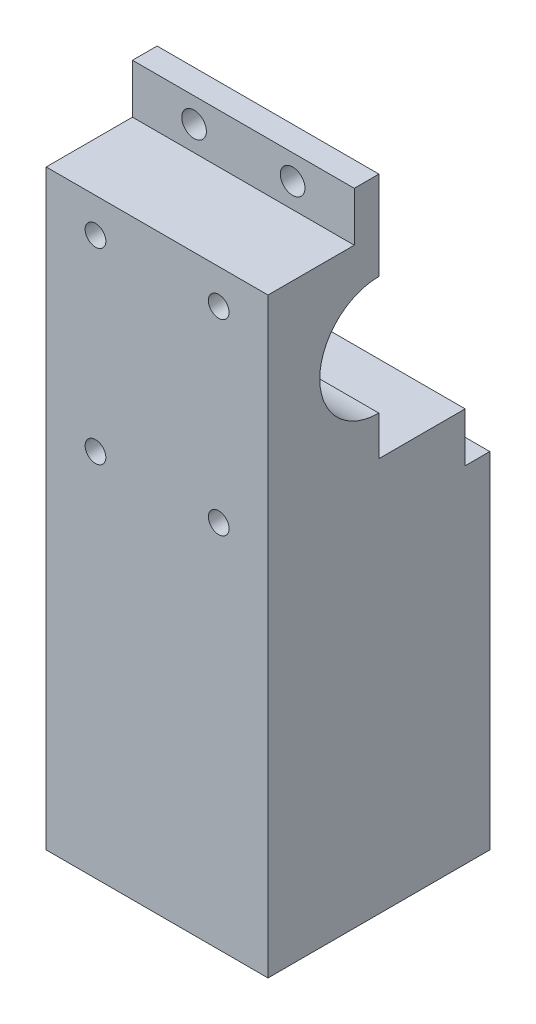
from build123d import *

# Parameters (mm, degrees)
SKETCH_1_W                       = 45
SKETCH_1_H                       = 45
EXTRUDE_1_DEPTH                  = 80
HOLE_WIZARD_M36_1_D              = 32
HOLE_WIZARD_M36_1_DEPTH          = 50
HOLE_WIZARD_M36_1_CSINK_D        = 38
HOLE_WIZARD_M36_1_CSINK_ANGLE    = 90
HOLE_WIZARD_M36_1_TIP            = 9.613769904
SKETCH_6_W                       = 5
SKETCH_6_H                       = 10
EXTRUDE_2_DEPTH                  = 45
SKETCH_7_R                       = 2.5
CUT_EXTRUDE_1_DEPTH              = 135.768319719
SKETCH_8_W                       = 5
SKETCH_8_H                       = 10
CUT_EXTRUDE_2_DEPTH              = 140.396018595
HOLE_WIZARD_M5_1_D               = 4.2
HOLE_WIZARD_M5_1_DEPTH           = 15
HOLE_WIZARD_M5_1_TIP             = 1.2618073
HOLE_WIZARD_M5_2_D               = 4.2
HOLE_WIZARD_M5_2_DEPTH           = 10
HOLE_WIZARD_M5_2_TIP             = 1.2618073
HOLE_WIZARD_M5_2_ON_FACE_2_D     = 4.2
HOLE_WIZARD_M5_2_ON_FACE_2_DEPTH = 10
HOLE_WIZARD_M5_2_ON_FACE_2_TIP   = 1.2618073


with BuildPart() as part:
    # 草图1 → 凸台-拉伸1 (new body)
    with BuildSketch(Plane(origin=(0, 0, 0), x_dir=(1, 0, 0), z_dir=(0, 1, 0))):
        Rectangle(SKETCH_1_W, SKETCH_1_H)
    extrude(amount=EXTRUDE_1_DEPTH)

    # M36 螺纹孔1
    with Locations(Plane(origin=(0, 0, 0), x_dir=(-1, 0, 0), z_dir=(0, -1, 0))):
        with Locations((0, 0)):
            CounterSinkHole(HOLE_WIZARD_M36_1_D / 2, HOLE_WIZARD_M36_1_CSINK_D / 2, depth=HOLE_WIZARD_M36_1_DEPTH, counter_sink_angle=HOLE_WIZARD_M36_1_CSINK_ANGLE)
            with Locations((0, 0, -(HOLE_WIZARD_M36_1_DEPTH + HOLE_WIZARD_M36_1_TIP / 2))):  # 118° drill point
                Cone(0, HOLE_WIZARD_M36_1_D / 2, HOLE_WIZARD_M36_1_TIP, mode=Mode.SUBTRACT)

    # 草图6 → 凸台-拉伸2 (add)
    with BuildSketch(Plane(origin=(22.5, 0, 0), x_dir=(0, 0, -1), z_dir=(1, 0, 0))):
        with BuildLine():
            Line((-22.5, 100), (-22.5, 80))
            Line((-22.5, 80), (0, 80))
            Line((0, 80), (0, 88))
            ThreePointArc((0, 88), (-8.485281374, 91.514718626), (-12, 100))
            Line((-12, 100), (-22.5, 100))
        make_face()
        with BuildLine():
            Line((-22.5, 120), (-22.5, 100))
            Line((-22.5, 100), (-12, 100))
            ThreePointArc((-12, 100), (-8.485281374, 108.485281374), (0, 112))
            Line((0, 112), (0, 120))
            Line((0, 120), (-5, 120))
            Line((-5, 120), (-22.5, 120))
        make_face()
        with Locations((-2.5, 125)):
            Rectangle(SKETCH_6_W, SKETCH_6_H)
    extrude(amount=-EXTRUDE_2_DEPTH)

    # 草图7 → 切除-拉伸1 (cut, through all)
    with BuildSketch(Plane.XY.offset(5)):
        with Locations((10, 125)):
            Circle(SKETCH_7_R)
        with Locations((-10, 125)):
            Circle(SKETCH_7_R)
    extrude(amount=-CUT_EXTRUDE_1_DEPTH, mode=Mode.SUBTRACT)

    # 草图8 → 切除-拉伸2 (cut, through all)
    with BuildSketch(Plane(origin=(22.5, 0, 0), x_dir=(0, 0, -1), z_dir=(1, 0, 0))):
        with Locations((20, 75)):
            Rectangle(SKETCH_8_W, SKETCH_8_H)
    extrude(amount=-CUT_EXTRUDE_2_DEPTH, mode=Mode.SUBTRACT)

    # M5 螺纹孔的螺纹孔钻头1
    with Locations(Plane(origin=(-12.5, 75, 22.5), x_dir=(1, 0, 0), z_dir=(0, 0, 1))):
        with Locations((0, 0), (25, 0)):
            Hole(HOLE_WIZARD_M5_1_D / 2, depth=HOLE_WIZARD_M5_1_DEPTH)
            with Locations((0, 0, -(HOLE_WIZARD_M5_1_DEPTH + HOLE_WIZARD_M5_1_TIP / 2))):  # 118° drill point
                Cone(0, HOLE_WIZARD_M5_1_D / 2, HOLE_WIZARD_M5_1_TIP, mode=Mode.SUBTRACT)

    # M5 螺纹孔的螺纹孔钻头2
    with Locations(Plane(origin=(12.5, 75, -17.5), x_dir=(-1, 0, 0), z_dir=(0, 0, -1))):
        with Locations((0, 0), (25, 0)):
            Hole(HOLE_WIZARD_M5_2_D / 2, depth=HOLE_WIZARD_M5_2_DEPTH)
            with Locations((0, 0, -(HOLE_WIZARD_M5_2_DEPTH + HOLE_WIZARD_M5_2_TIP / 2))):  # 118° drill point
                Cone(0, HOLE_WIZARD_M5_2_D / 2, HOLE_WIZARD_M5_2_TIP, mode=Mode.SUBTRACT)

    # M5 螺纹孔的螺纹孔钻头2 on face 2
    with Locations(Plane(origin=(-12.5, 113, 22.5), x_dir=(1, 0, 0), z_dir=(0, 0, 1))):
        with Locations((0, 0), (25, 0)):
            Hole(HOLE_WIZARD_M5_2_ON_FACE_2_D / 2, depth=HOLE_WIZARD_M5_2_ON_FACE_2_DEPTH)
            with Locations((0, 0, -(HOLE_WIZARD_M5_2_ON_FACE_2_DEPTH + HOLE_WIZARD_M5_2_ON_FACE_2_TIP / 2))):  # 118° drill point
                Cone(0, HOLE_WIZARD_M5_2_ON_FACE_2_D / 2, HOLE_WIZARD_M5_2_ON_FACE_2_TIP, mode=Mode.SUBTRACT)


solid = part.part
